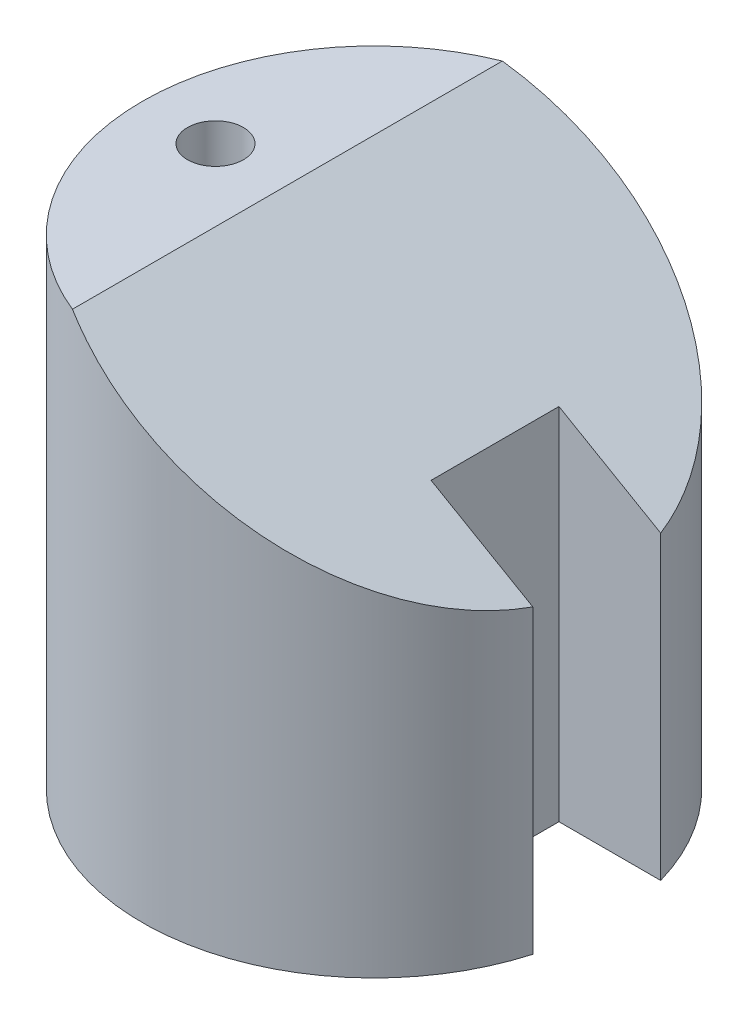
from build123d import *

# Parameters (mm, degrees)
SKETCH3_R           = 29
BOSS_EXTRUDE1_DEPTH = 60
CUT_EXTRUDE1_DEPTH  = 30
SKETCH8_R           = 3.5
CUT_EXTRUDE2_DEPTH  = 20
SKETCH15_W          = 16
SKETCH15_H          = 16
CUT_EXTRUDE4_DEPTH  = 61


with BuildPart() as part:
    # Sketch3 → Boss-Extrude1 (new body)
    with BuildSketch(Plane(origin=(0, 0, 0), x_dir=(1, 0, 0), z_dir=(0, 1, 0))):
        with Locations(Location((0, 0, 0), (0, 0, 270))):
            Circle(SKETCH3_R)
    extrude(amount=BOSS_EXTRUDE1_DEPTH)

    # Sketch6 → Cut-Extrude1 (cut, symmetric)
    with BuildSketch(Plane.XY):
        Polygon((-10.837168574, 60), (29, 37), (29, 60), align=None)
    extrude(amount=CUT_EXTRUDE1_DEPTH, both=True, mode=Mode.SUBTRACT)

    # Sketch8 → Cut-Extrude2 (cut)
    with BuildSketch(Plane(origin=(0, 60, 0), x_dir=(1, 0, 0), z_dir=(0, 1, 0))):
        with Locations(Location((-19.837168574, 0, 0), (0, 0, 270))):
            Circle(SKETCH8_R)
    extrude(amount=-CUT_EXTRUDE2_DEPTH, mode=Mode.SUBTRACT)

    # Sketch15 → Cut-Extrude4 (cut, along a direction that is not the sketch's normal)
    with BuildSketch(Plane(origin=(23.27146997, 40.307368355, 0), x_dir=(0.8660254037844416, -0.49999999999999484, 0), z_dir=(0.49999999999999484, 0.8660254037844416, 0))):
        with Locations((-1.38526329, 0)):
            Rectangle(SKETCH15_W, SKETCH15_H)
    extrude(amount=-CUT_EXTRUDE4_DEPTH, dir=(0, 1, 0), mode=Mode.SUBTRACT)


solid = part.part
